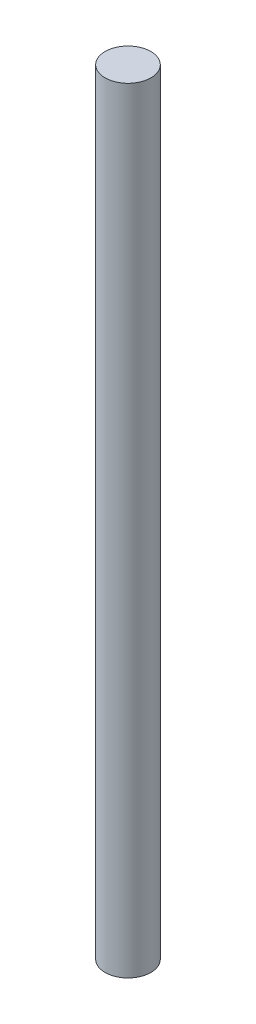
from build123d import *

# Parameters (mm, degrees)
SKETCH1_R           = 14.75
BOSS_EXTRUDE1_DEPTH = 500


with BuildPart() as part:
    # Sketch1 → Boss-Extrude1 (new body)
    with BuildSketch(Plane(origin=(0, 0, 0), x_dir=(1, 0, 0), z_dir=(0, 1, 0))):
        with Locations(Location((0, 0, 0), (0, 0, 270))):
            Circle(SKETCH1_R)
    extrude(amount=BOSS_EXTRUDE1_DEPTH)


solid = part.part
